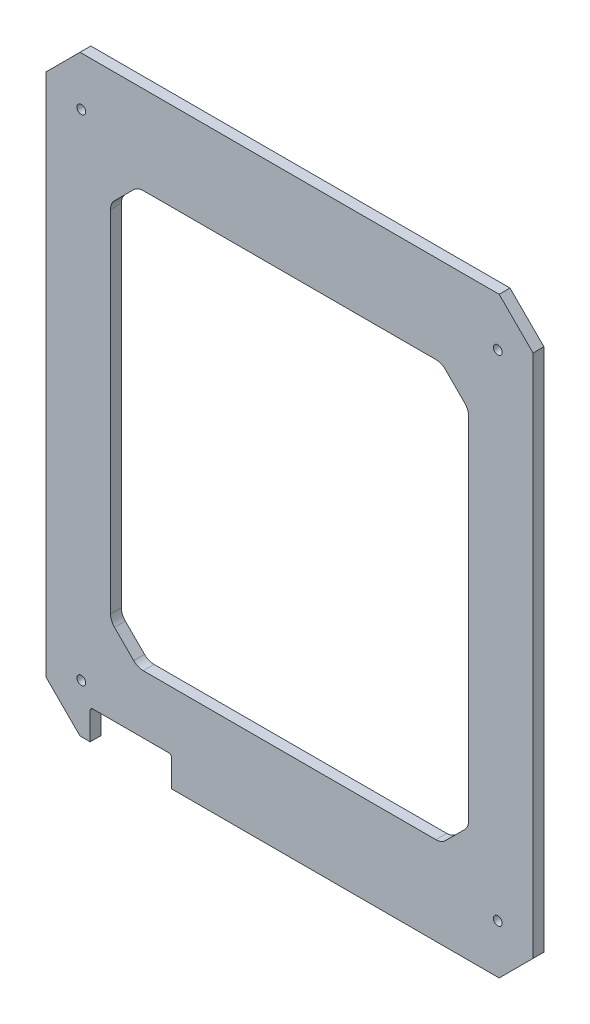
from build123d import *

# Parameters (mm, degrees)
BOSS_EXTRUDE1_DEPTH        = 8
CUT_EXTRUDE1_DEPTH         = 283.696502476
CUT_EXTRUDE2_DEPTH         = 283.696502476
F_6_5_6_5_DIAMETER_HOLE2_D = 6.5
CUT_EXTRUDE3_REACH         = 284.697


with BuildPart() as part:
    # Sketch1 → Boss-Extrude1 (new body)
    with BuildSketch(Plane.XY.offset(8)):
        Polygon((-154.499999959, -218.249999957), (154.500000044, -218.249999957), (179.500000086, -193.249999916), (179.500000086, 193.249999916), (154.500000044, 218.249999957), (-154.499999959, 218.249999957), (-179.5, 193.249999916), (-179.5, -193.249999916), align=None)
    extrude(amount=-BOSS_EXTRUDE1_DEPTH)

    # Sketch2 → Cut-Extrude1 (cut, through all)
    with BuildSketch(Plane(origin=(0, 0, 0), x_dir=(-1, 0, 0), z_dir=(0, 0, -1))):
        with BuildLine():
            Line((-107.857864329, -153.249999987), (107.857864423, -153.249999987))
            ThreePointArc((107.857864423, -153.249999987), (111.684698748, -152.488795312), (114.928932237, -150.321067798))
            Line((114.928932237, -150.321067798), (129.071067861, -136.178932174))
            ThreePointArc((129.071067861, -136.178932174), (131.23879537, -132.934698692), (132.000000044, -129.107864376))
            Line((132.000000044, -129.107864376), (132.000000044, 129.107864376))
            ThreePointArc((132.000000044, 129.107864376), (131.23879537, 132.934698692), (129.071067861, 136.178932174))
            Line((129.071067861, 136.178932174), (114.928932237, 150.321067798))
            ThreePointArc((114.928932237, 150.321067798), (111.684698748, 152.488795312), (107.857864423, 153.249999987))
            Line((107.857864423, 153.249999987), (-107.857864329, 153.249999987))
            ThreePointArc((-107.857864329, 153.249999987), (-111.684698653, 152.488795312), (-114.928932143, 150.321067798))
            Line((-114.928932143, 150.321067798), (-129.071067767, 136.178932174))
            ThreePointArc((-129.071067767, 136.178932174), (-131.238795276, 132.934698692), (-131.999999949, 129.107864376))
            Line((-131.999999949, 129.107864376), (-131.999999949, -129.107864376))
            ThreePointArc((-131.999999949, -129.107864376), (-131.238795276, -132.934698692), (-129.071067767, -136.178932174))
            Line((-129.071067767, -136.178932174), (-114.928932143, -150.321067798))
            ThreePointArc((-114.928932143, -150.321067798), (-111.684698653, -152.488795312), (-107.857864329, -153.249999987))
        make_face()
    extrude(amount=-CUT_EXTRUDE1_DEPTH, mode=Mode.SUBTRACT)

    # Sketch3 → Cut-Extrude2 (cut, through all)
    with BuildSketch(Plane(origin=(0, 0, 0), x_dir=(-1, 0, 0), z_dir=(0, 0, -1))):
        with BuildLine():
            Line((134.249999927, -198.50000003), (124.249999986, -198.50000003))
            ThreePointArc((124.249999986, -198.50000003), (122.835786445, -199.085786459), (122.250000016, -200.5))
            Line((122.250000016, -200.5), (122.250000016, -209.5))
            ThreePointArc((122.250000016, -209.5), (122.835786436, -210.91421352), (124.249999956, -211.49999994))
            Line((124.249999956, -211.49999994), (134.249999956, -211.49999994))
            ThreePointArc((134.249999956, -211.49999994), (135.664213457, -210.914213528), (136.249999869, -209.500000027))
            Line((136.249999869, -209.500000027), (136.249999869, -200.499999973))
            ThreePointArc((136.249999869, -200.499999973), (135.664213448, -199.085786451), (134.249999927, -198.50000003))
        make_face()
    extrude(amount=-CUT_EXTRUDE2_DEPTH, mode=Mode.SUBTRACT)

    # Ø6.5 (6.5) Diameter Hole2 (through all)
    with Locations(Plane(origin=(0, 0, 0), x_dir=(-1, 0, 0), z_dir=(0, 0, -1))):
        with Locations((-153.5, -182.25), (153.5, -182.25), (-153.5, 182.25), (153.5, 182.25)):
            Hole(F_6_5_6_5_DIAMETER_HOLE2_D / 2)

    # Sketch8 → Cut-Extrude3 (cut, up to next)
    with BuildSketch(Plane.XY.offset(8), mode=Mode.PRIVATE) as cut_extrude3_sk1:
        with BuildLine():
            Line((-89, -196.249999957), (-145, -196.249999957))
            ThreePointArc((-145, -196.249999957), (-146.414213562, -196.835786395), (-147, -198.249999957))
            Line((-147, -198.249999957), (-147, -218.249999957))
            Line((-147, -218.249999957), (-87, -218.249999957))
            Line((-87, -218.249999957), (-87, -198.249999957))
            ThreePointArc((-87, -198.249999957), (-87.585786438, -196.835786395), (-89, -196.249999957))
        make_face()
    cut_extrude3_tool1 = extrude(cut_extrude3_sk1.sketch, amount=-CUT_EXTRUDE3_REACH, mode=Mode.PRIVATE) & part.part
    add(cut_extrude3_tool1.solids().sort_by_distance((-117, -207.263744, 8))[0], mode=Mode.SUBTRACT)


solid = part.part
